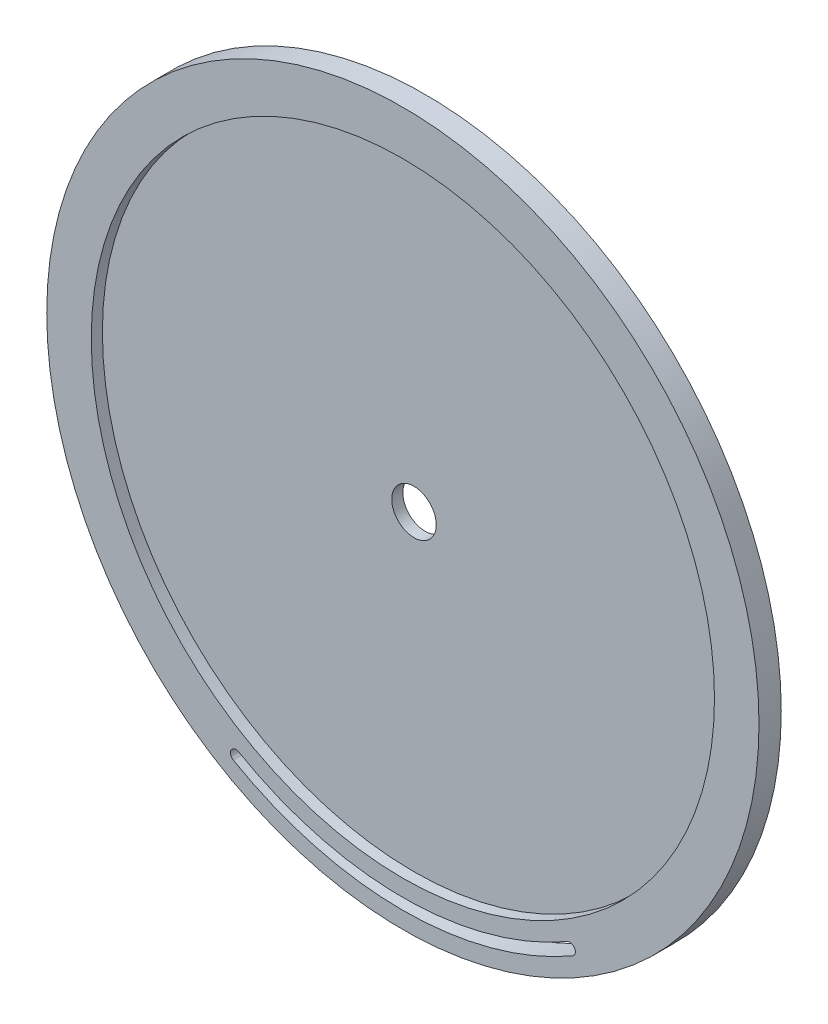
from build123d import *

# Parameters (mm, degrees)
SKETCH1_R      = 101.6
RADIUS_DEPTH   = 6.35
SKETCH4_R      = 88.9
EXTRUDE4_DEPTH = 3.175
EXTRUDE5_DEPTH = 144.824345992
SKETCH14_R     = 6.35
EXTRUDE6_DEPTH = 6.35


with BuildPart() as part:
    # Sketch1 → Radius (new body)
    with BuildSketch(Plane.XY):
        Circle(SKETCH1_R)
    extrude(amount=RADIUS_DEPTH)

    # Sketch4 → Extrude4 (cut)
    with BuildSketch(Plane.XY.offset(6.35)):
        Circle(SKETCH4_R)
    extrude(amount=-EXTRUDE4_DEPTH, mode=Mode.SUBTRACT)

    # Sketch7 → Extrude5 (cut, through all)
    with BuildSketch(Plane.XY.offset(6.35)):
        with BuildLine():
            ThreePointArc((46.83125, -81.114104382), (0, -93.6625), (-46.83125, -81.114104382))
            ThreePointArc((-46.83125, -81.114104382), (-48.999815329, -81.69516971), (-48.41875, -83.863735039))
            ThreePointArc((-48.41875, -83.863735039), (0, -96.8375), (48.41875, -83.863735039))
            ThreePointArc((48.41875, -83.863735039), (48.999815329, -81.69516971), (46.83125, -81.114104382))
        make_face()
    extrude(amount=-EXTRUDE5_DEPTH, mode=Mode.SUBTRACT)

    # Sketch14 → Extrude6 (cut)
    with BuildSketch(Plane.XY.offset(3.175)):
        Circle(SKETCH14_R)
    extrude(amount=-EXTRUDE6_DEPTH, mode=Mode.SUBTRACT)


solid = part.part
